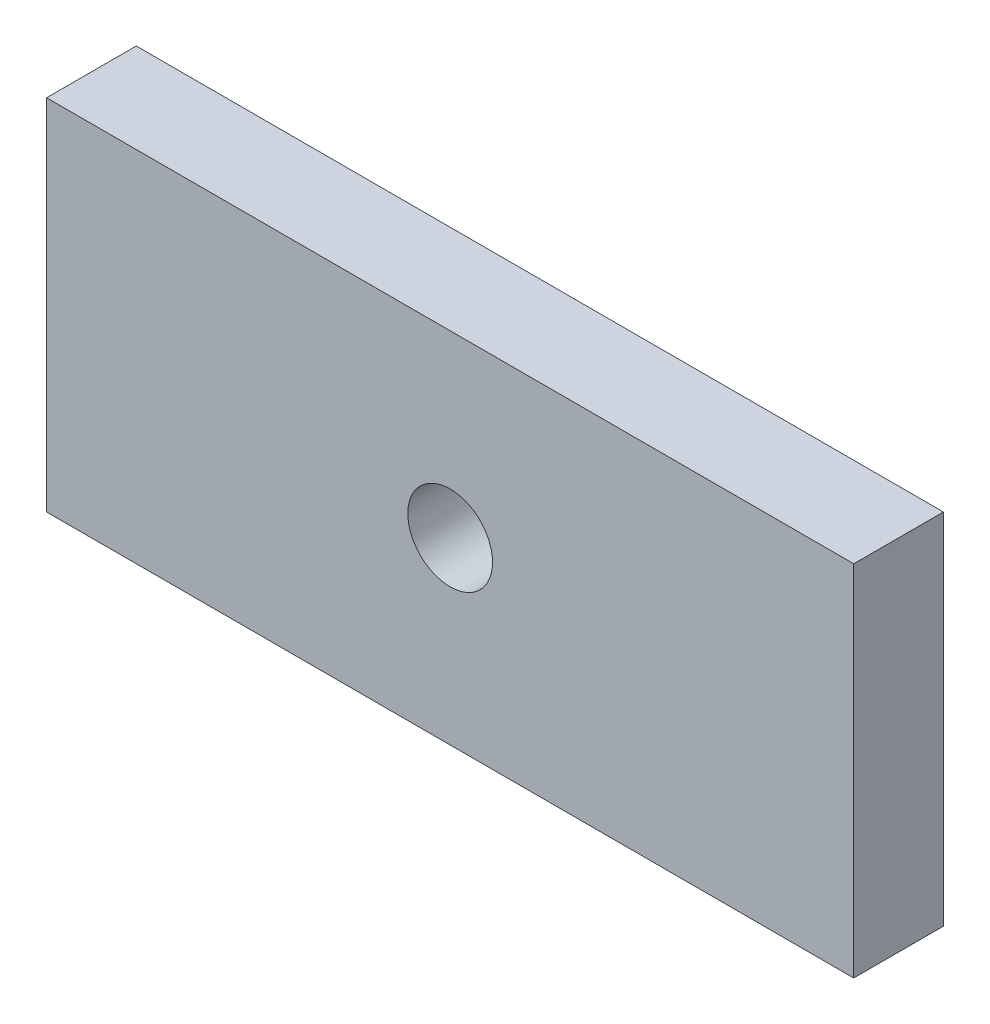
from build123d import *

# Parameters (mm, degrees)
SKETCH1_W           = 114.3
SKETCH1_H           = 50.8
SKETCH1_R           = 6
BOSS_EXTRUDE1_DEPTH = 12.7


with BuildPart() as part:
    # Sketch1 → Boss-Extrude1 (new body)
    with BuildSketch(Plane.XY):
        with Locations((57.15, 25.4)):
            Rectangle(SKETCH1_W, SKETCH1_H)
        with Locations((57.15, 25.4)):
            Circle(SKETCH1_R, mode=Mode.SUBTRACT)
    extrude(amount=BOSS_EXTRUDE1_DEPTH)


solid = part.part
